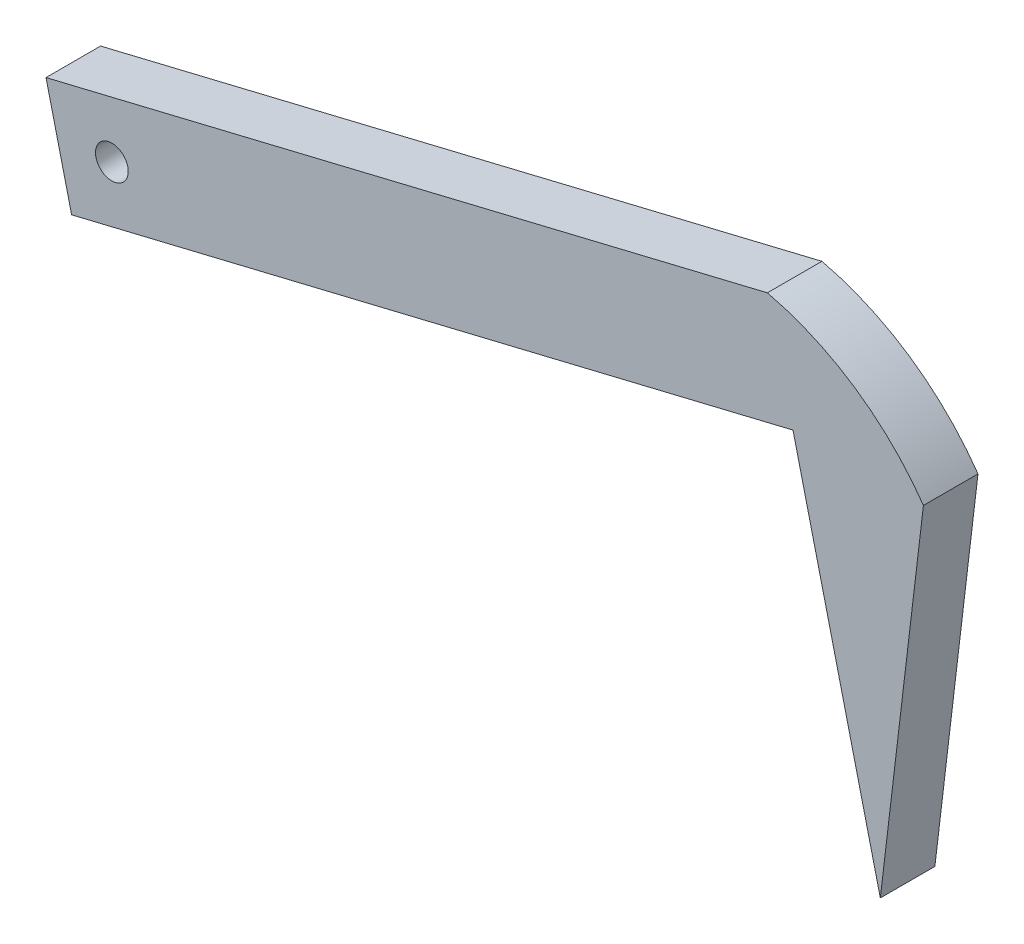
from build123d import *

# Parameters (mm, degrees)
ESQUISSE1_R        = 1.5
BOSS_EXTRU_1_DEPTH = 5


with BuildPart() as part:
    # Esquisse1 → Boss.-Extru.1 (new body)
    with BuildSketch(Plane.XY):
        with BuildLine():
            Line((80.399280561, 6.246686232), (76.448974575, -26.879380538))
            Line((76.448974575, -26.879380538), (68.446905782, 6.246686232))
            Line((68.446905782, 6.246686232), (2.348102713, -9.720412216))
            Line((2.348102713, -9.720412216), (0, 0))
            Line((0, 0), (66.098803069, 15.967098448))
            ThreePointArc((66.098803069, 15.967098448), (74.143232039, 12.422407246), (80.399280561, 6.246686232))
        make_face()
        with Locations((6.034257464, -3.686154752)):
            Circle(ESQUISSE1_R, mode=Mode.SUBTRACT)
    extrude(amount=BOSS_EXTRU_1_DEPTH)


solid = part.part
